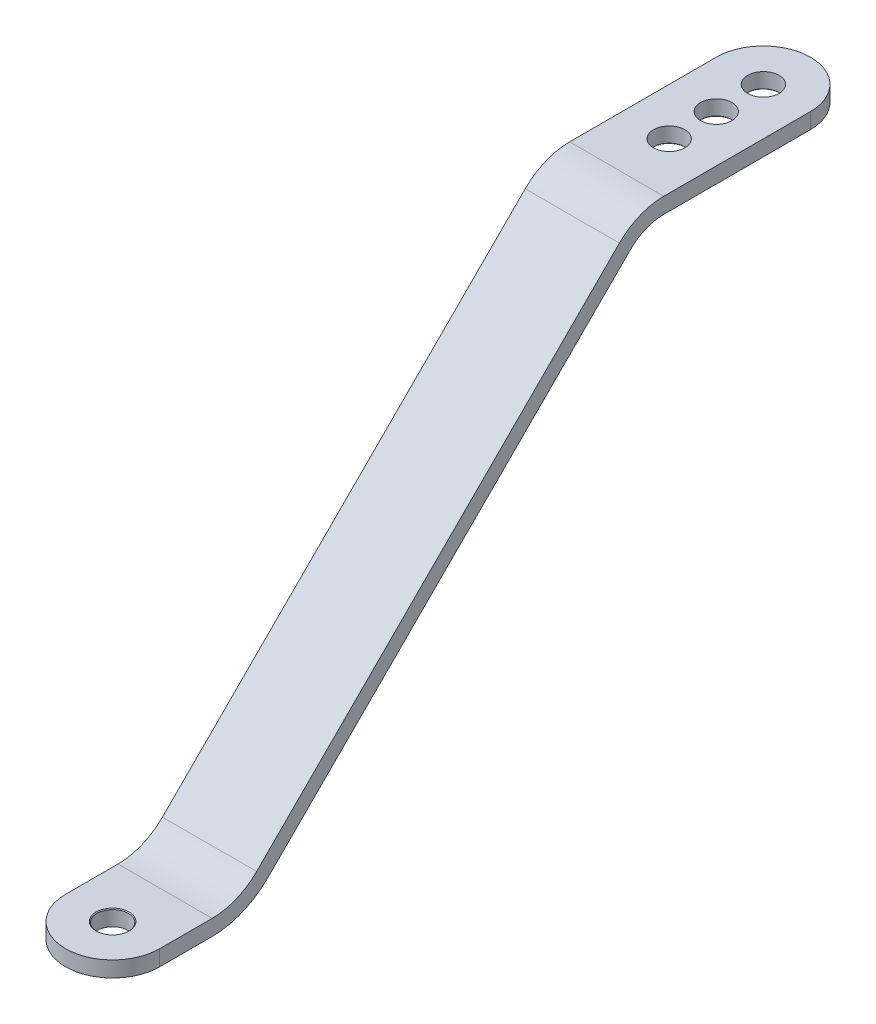
from build123d import *

# Parameters (mm, degrees)
BOSS_EXTRUDE1_DEPTH = 76.2
FILLET1_RADIUS      = 38.1
FILLET1_LENGTH      = 12.7
FILLET2_RADIUS      = 38.1
FILLET2_LENGTH      = 12.7
LPATTERN1_COUNT     = 3
LPATTERN1_PITCH     = 38.1


with BuildPart() as part:
    # Sketch2 → Boss-Extrude1 (new body)
    with BuildSketch(Plane(origin=(0, 0, 0), x_dir=(0, 0, -1), z_dir=(1, 0, 0))):
        with BuildLine():
            Line((-263.244610179, 0), (-182.686659148, 0))
            ThreePointArc((-182.686659148, 0), (-163.246340784, 3.866919748), (-146.765634664, 14.878975516))
            Line((-146.765634664, 14.878975516), (146.765634664, 308.410244843))
            ThreePointArc((146.765634664, 308.410244843), (163.246340784, 319.42230061), (182.686659148, 323.289220358))
            Line((182.686659148, 323.289220358), (339.444610179, 323.289220358))
            Line((339.444610179, 323.289220358), (339.444610179, 310.589220358))
            Line((339.444610179, 310.589220358), (182.686659148, 310.589220358))
            ThreePointArc((182.686659148, 310.589220358), (168.106420375, 307.689030547), (155.745890785, 299.429988722))
            Line((155.745890785, 299.429988722), (-137.785378542, 5.898719395))
            ThreePointArc((-137.785378542, 5.898719395), (-158.386261193, -7.866350314), (-182.686659148, -12.7))
            Line((-182.686659148, -12.7), (-263.244610179, -12.7))
            Line((-263.244610179, -12.7), (-263.244610179, 0))
        make_face()
    extrude(amount=BOSS_EXTRUDE1_DEPTH)

    # Fillet1: full round fillet: the end face becomes a half cylinder, R = half its width
    fillet1_face = Plane((38.1, -6.35, 263.244610179), x_dir=(0, -1, 0), z_dir=(0, 0, 1))  # on the end face: x along it, z out of the body
    fillet1_slab = fillet1_face.offset(-FILLET1_RADIUS / 2) * Box(FILLET1_LENGTH, 2 * FILLET1_RADIUS, FILLET1_RADIUS, mode=Mode.PRIVATE)  # the body's end, R deep
    fillet1_round = Plane((38.1, -6.35, 225.144610179), x_dir=(0, 0, 1), z_dir=(0, -1, 0)) * Cylinder(FILLET1_RADIUS, FILLET1_LENGTH, mode=Mode.PRIVATE)  # its axis R under the face
    add(fillet1_slab - fillet1_round, mode=Mode.SUBTRACT)

    # Fillet2: full round fillet: the end face becomes a half cylinder, R = half its width
    fillet2_face = Plane((38.1, 316.939220358, -339.444610179), x_dir=(0, 1, 0), z_dir=(0, 0, -1))  # on the end face: x along it, z out of the body
    fillet2_slab = fillet2_face.offset(-FILLET2_RADIUS / 2) * Box(FILLET2_LENGTH, 2 * FILLET2_RADIUS, FILLET2_RADIUS, mode=Mode.PRIVATE)  # the body's end, R deep
    fillet2_round = Plane((38.1, 316.939220358, -301.344610179), x_dir=(0, 0, -1), z_dir=(0, 1, 0)) * Cylinder(FILLET2_RADIUS, FILLET2_LENGTH, mode=Mode.PRIVATE)  # its axis R under the face
    add(fillet2_slab - fillet2_round, mode=Mode.SUBTRACT)

    # Sketch4 → 1 (1) Diameter Hole1 (revolve, cut)
    with BuildSketch(Plane(origin=(38.1, 0, 225.144610179), x_dir=(0, 0, 1), z_dir=(1, 0, 0))):
        Polygon((0, 0), (0, 12.7), (12.7, 12.7), (12.7, 0.635), (13.335, 0), align=None)
    revolve(axis=Axis((38.1, 6.35, 225.144610179), (0, -1, 0)), mode=Mode.SUBTRACT)

    # Sketch7 → 1 (1) Diameter Hole2 (revolve, cut)
    with BuildSketch(Plane(origin=(38.1, 310.589220358, -301.344610179), x_dir=(0, 0, -1), z_dir=(1, 0, 0))):
        Polygon((0, 0), (0, 12.7), (12.7, 12.7), (12.7, 0.635), (13.335, 0), align=None)
    f_1_1_diameter_hole2 = revolve(axis=Axis((38.1, 304.239220358, -301.344610179), (0, 1, 0)), mode=Mode.SUBTRACT)

    # LPattern1: 1 (1) Diameter Hole2 ×3
    with Locations(*[(0, 0, i * LPATTERN1_PITCH) for i in range(1, LPATTERN1_COUNT)]):
        add(f_1_1_diameter_hole2, mode=Mode.SUBTRACT)


solid = part.part
